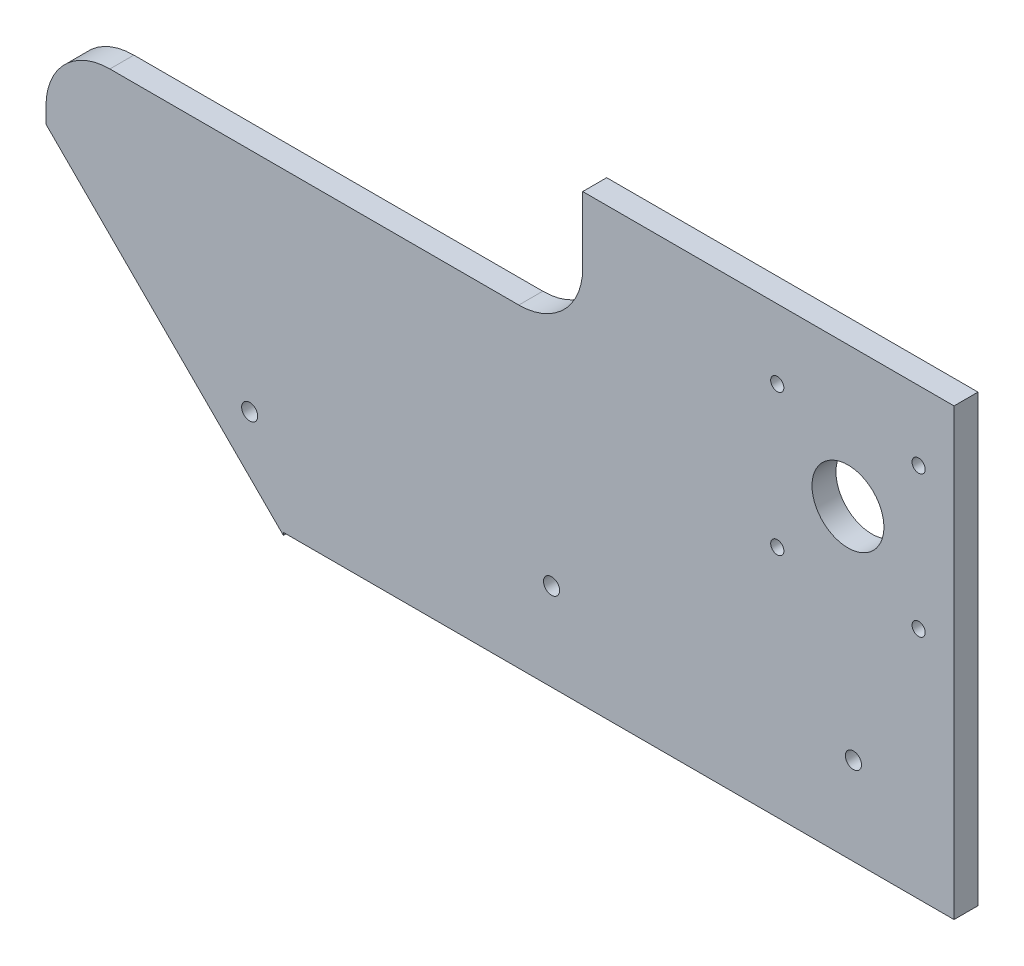
from build123d import *

# Parameters (mm, degrees)
SKETCH1_R                    = 14.2875
BOSS_EXTRUDE1_DEPTH          = 9.525
SKETCH2_W                    = 285.640227578
SKETCH2_H                    = 77.156349518
CUT_EXTRUDE1_DEPTH           = 267.58430025
SKETCH4_W                    = 213.36
SKETCH4_H                    = 65.465352004
CUT_EXTRUDE2_DEPTH           = 267.58430025
FILLET2_R                    = 25.4
SKETCH16_W                   = 9.525
SKETCH16_H                   = 0.985363282
CUT_EXTRUDE3_DEPTH           = 390.572219806
SKETCH17_W                   = 147.610011278
SKETCH17_H                   = 12.7
CUT_EXTRUDE4_DEPTH           = 267.045158533
TAP_DRILL_FOR_M6X0_75_TAP1_D = 5.25
F_6_4_6_4_DIAMETER_HOLE1_D   = 6.4


with BuildPart() as part:
    # Sketch1 → Boss-Extrude1 (new body)
    with BuildSketch(Plane.XY):
        Polygon((-138.259383474, 48.991487021), (32.210627804, -121.478524257), (222.710627804, -121.478524257), (222.710627804, 146.206839025), (-138.259383474, 146.206839025), align=None)
        with Locations(Location((180.538014078, 76.831975743, 0), (0, 0, 180))):
            Circle(SKETCH1_R, mode=Mode.SUBTRACT)
    extrude(amount=BOSS_EXTRUDE1_DEPTH)

    # Sketch2 → Cut-Extrude1 (cut, through all)
    with BuildSketch(Plane.XY.offset(9.525)):
        with Locations((98.940514015, -82.900349498)):
            Rectangle(SKETCH2_W, SKETCH2_H)
    extrude(amount=-CUT_EXTRUDE1_DEPTH, mode=Mode.SUBTRACT)

    # Sketch4 → Cut-Extrude2 (cut, through all)
    with BuildSketch(Plane.XY.offset(9.525)):
        with Locations((-31.579383474, 113.474163023)):
            Rectangle(SKETCH4_W, SKETCH4_H)
    extrude(amount=-CUT_EXTRUDE2_DEPTH, mode=Mode.SUBTRACT)

    # Fillet2
    fillet2_edges = [part.edges().sort_by_distance(p)[0] for p in [
        (-138.259383474, 80.741487021, 4.7625),
        (75.100616526, 80.741487021, 4.7625),
    ]]
    fillet(fillet2_edges, radius=FILLET2_R)

    # Sketch16 → Cut-Extrude3 (cut, through all)
    with BuildSketch(Plane(origin=(222.710627804, 0, 0), x_dir=(0, 0, -1), z_dir=(1, 0, 0))):
        with Locations((-4.7625, 145.714157384)):
            Rectangle(SKETCH16_W, SKETCH16_H)
    extrude(amount=-CUT_EXTRUDE3_DEPTH, mode=Mode.SUBTRACT)

    # Sketch17 → Cut-Extrude4 (cut, through all)
    with BuildSketch(Plane(origin=(0, 0, 0), x_dir=(-1, 0, 0), z_dir=(0, 0, -1))):
        with Locations((-148.905622165, 138.871475743)):
            Rectangle(SKETCH17_W, SKETCH17_H)
    extrude(amount=-CUT_EXTRUDE4_DEPTH, mode=Mode.SUBTRACT)

    # Tap Drill for M6x0.75 Tap1 (through all)
    with Locations(Plane.XY.offset(9.525)):
        with Locations((208.638014078, 104.931975743), (152.438014078, 104.931975743), (152.438014078, 48.731975743), (208.638014078, 48.731975743)):
            Hole(TAP_DRILL_FOR_M6X0_75_TAP1_D / 2)

    # Ø6.4 (6.4) Diameter Hole1 (through all)
    with Locations(Plane.XY.offset(9.525)):
        with Locations((-57.289372206, -9.464524257), (62.710627794, -9.464524257), (182.710627794, -9.464524257)):
            Hole(F_6_4_6_4_DIAMETER_HOLE1_D / 2)


solid = part.part
